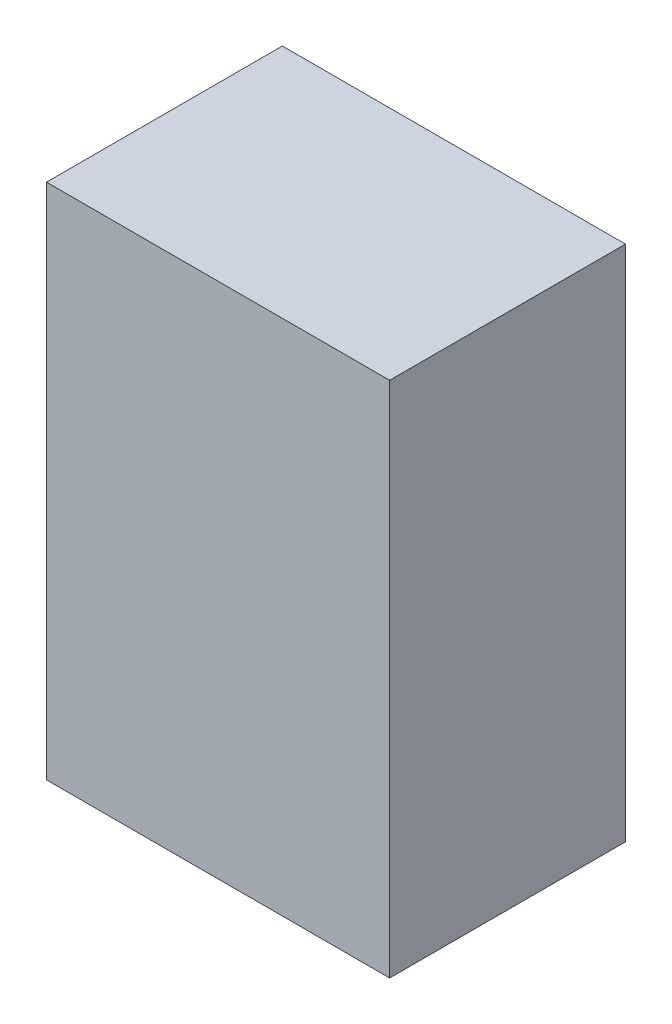
from build123d import *

# Parameters (mm, degrees)
SKETCH1_W           = 58.2
SKETCH1_H           = 87.8
BOSS_EXTRUDE1_DEPTH = 20


with BuildPart() as part:
    # Sketch1 → Boss-Extrude1 (new, symmetric)
    with BuildSketch(Plane.XY):
        Rectangle(SKETCH1_W, SKETCH1_H)
    extrude(amount=BOSS_EXTRUDE1_DEPTH, both=True)


solid = part.part
